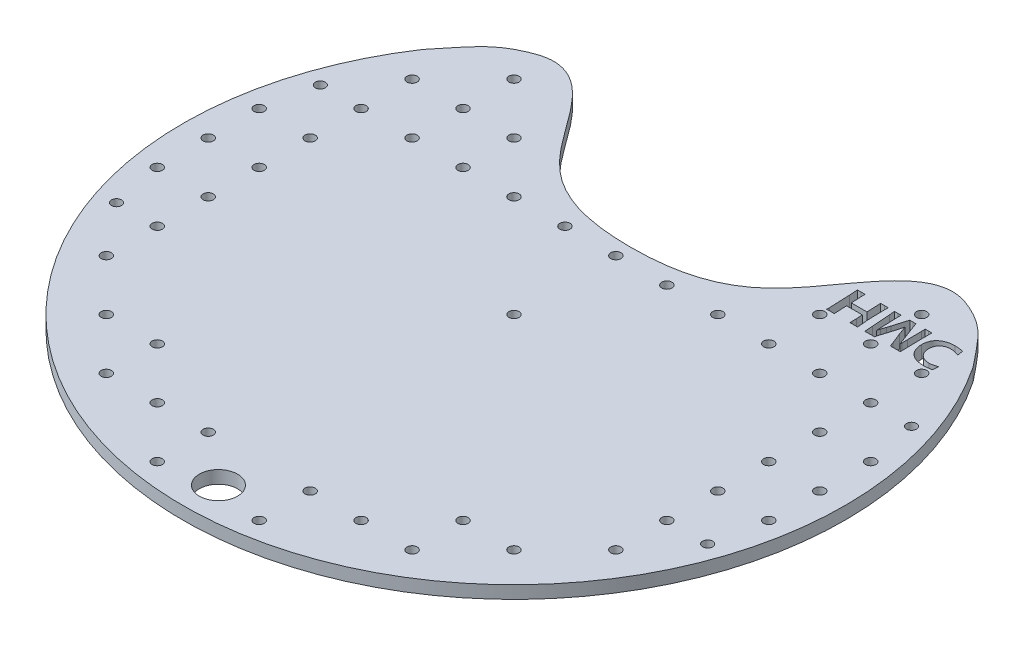
from build123d import *

# Parameters (mm, degrees)
SKETCH1_R               = 164.975
BOSS_EXTRUDE1_DEPTH     = 6.35
F_10_CLEARANCE_HOLE1_D  = 4.9784
CUT_EXTRUDE1_DEPTH      = 234.396280497
CUT_EXTRUDE1_DEPTH_BACK = 234.396280497
LPATTERN2_COUNT         = 7
LPATTERN2_PITCH         = 25.4
LPATTERN2_COUNT_DIR2    = 7
LPATTERN2_PITCH_DIR2    = 25.4
LPATTERN3_COUNT         = 5
LPATTERN3_PITCH         = 25.4
LPATTERN3_COUNT_DIR2    = 7
LPATTERN3_PITCH_DIR2    = 25.4
CUT_EXTRUDE2_DEPTH      = 234.396280641
SKETCH11_R              = 9.525
CUT_EXTRUDE3_DEPTH      = 234.396280641


with BuildPart() as part:
    # Sketch1 → Boss-Extrude1 (new body)
    with BuildSketch(Plane(origin=(0, 0, 0), x_dir=(1, 0, 0), z_dir=(0, 1, 0))):
        with Locations(Location((0, 0, 0), (0, 0, 270))):
            Circle(SKETCH1_R)
    extrude(amount=BOSS_EXTRUDE1_DEPTH)

    # #10 Clearance Hole1 (through all)
    with Locations(Plane(origin=(0, 6.35, 0), x_dir=(-1, 0, 0), z_dir=(0, 1, 0))):
        with Locations((147.32, 50.8), (147.32, -50.8), (-147.32, -50.8), (-147.32, 50.8)):
            Hole(F_10_CLEARANCE_HOLE1_D / 2)

    # Sketch5 → Cut-Extrude1 (cut, two sides: drawn at the far end of the back side and taken through both)
    with BuildSketch(Plane(origin=(0, 6.35, 0), x_dir=(1, 0, 0), z_dir=(0, 1, 0)).offset(-CUT_EXTRUDE1_DEPTH_BACK)):
        with BuildLine():
            ThreePointArc((137.173488465, 91.652521446), (0, 164.975), (-137.173488464, 91.652521447))
            add(Edge.make_bspline(
                [(-137.173488464, 91.652521447), (-125.705159191, 105.996558727), (-120.870534515, 112.272122591), (-90.353097544, 124.765284351), (-63.363213117, 88.003441051), (-42.154841731, 58.106834512), (1e-09, 58.106834512)],
                knots=[0, 0, 0, 0, 0.216330934, 0.275013743, 0.586828091, 1, 1, 1, 1], degree=3))
            add(Edge.make_bspline(
                [(137.173488466, 91.652521447), (125.705159193, 105.996558727), (120.870534517, 112.272122591), (90.353097545, 124.765284351), (63.363213118, 88.003441051), (42.154841732, 58.106834512), (1e-09, 58.106834512)],
                knots=[0, 0, 0, 0, 0.216330934, 0.275013743, 0.586828091, 1, 1, 1, 1], degree=3))
        make_face()
    extrude(amount=CUT_EXTRUDE1_DEPTH + CUT_EXTRUDE1_DEPTH_BACK, mode=Mode.SUBTRACT)

    # Sketch8 → #10 Clearance Hole2 (revolve, cut)
    with BuildSketch(Plane(origin=(0, 0, 0), x_dir=(0, 0, -1), z_dir=(1, 0, 0))):
        Polygon((0, 0), (0, 7.883816902), (2.5527, 6.35), (2.5527, 0), align=None)
    f_10_clearance_hole2 = revolve(axis=Axis((0, -6.35, 0), (0, 1, 0)), mode=Mode.SUBTRACT)

    # LPattern2: 10 Clearance Hole2 7 × 7, 36 skipped
    with Locations(*[(-i * LPATTERN2_PITCH, 0, j * LPATTERN2_PITCH_DIR2) for i in range(LPATTERN2_COUNT) for j in range(LPATTERN2_COUNT_DIR2) if (i, j) not in ((0, 0), (0, 1), (0, 2), (0, 3), (0, 4), (0, 5), (0, 6), (1, 0), (1, 1), (1, 2), (1, 3), (1, 4), (2, 0), (2, 1), (2, 2), (2, 3), (2, 4), (2, 6), (3, 0), (3, 1), (3, 2), (3, 3), (3, 6), (4, 0), (4, 1), (4, 2), (4, 3), (4, 5), (4, 6), (5, 4), (5, 5), (5, 6), (6, 2), (6, 3), (6, 4), (6, 5), (6, 6))]):
        add(f_10_clearance_hole2, mode=Mode.SUBTRACT)

    # LPattern3: 10 Clearance Hole2 5 × 7, 20 skipped
    with Locations(*[(-j * LPATTERN3_PITCH_DIR2, 0, -i * LPATTERN3_PITCH) for i in range(LPATTERN3_COUNT) for j in range(LPATTERN3_COUNT_DIR2) if (i, j) not in ((0, 0), (0, 1), (0, 2), (0, 3), (0, 4), (1, 0), (1, 1), (1, 2), (1, 3), (1, 4), (2, 6), (3, 0), (3, 1), (3, 2), (3, 6), (4, 0), (4, 1), (4, 2), (4, 3), (4, 5), (4, 6))]):
        add(f_10_clearance_hole2, mode=Mode.SUBTRACT)

    # Sketch10 → Cut-Extrude2 (cut, through all)
    with BuildSketch(Plane.XZ):
        with BuildLine():
            Line((74.993500001, -96.206834512), (75.260894532, -91.997975137))
            add(Edge.make_bspline(
                [(75.260894532, -91.997975137), (75.296562067, -91.434304127), (75.366562515, -90.328053782), (75.453626376, -88.698154201), (75.521456861, -87.130668601), (75.57094484, -85.870076422), (75.595967468, -84.914860995), (75.619923895, -84.262155806), (75.631210718, -83.663567502), (75.646271295, -83.121893626), (75.657307485, -82.635722801), (75.662386599, -82.206223979), (75.672282965, -81.831232152), (75.671176771, -81.599689665), (75.670667969, -81.493189981)],
                knots=[0, 0, 0, 0, 1.933852701, 3.795343699, 5.588570132, 7.305909625, 8.114800428, 8.860305979, 9.542201477, 10.164663024, 10.715709075, 11.207239194, 11.635363789, 12, 12, 12, 12], degree=3))
            Line((75.670667969, -81.493189981), (75.656777344, -80.204834512))
            add(Edge.make_bspline(
                [(75.656777344, -80.204834512), (75.873235113, -80.208656794), (76.272573451, -80.21570844), (76.820137012, -80.220481942), (77.265744768, -80.230600362), (77.528535454, -80.229585626), (77.643136719, -80.229143106)],
                knots=[0, 0, 0, 0, 1.307740905, 2.412623416, 3.307755656, 4, 4, 4, 4], degree=3))
            add(Edge.make_bspline(
                [(77.643136719, -80.229143106), (77.684808111, -80.22909413), (77.777411203, -80.228985293), (77.930229256, -80.230002988), (78.111936136, -80.224998579), (78.321460799, -80.222141476), (78.559915111, -80.218503149), (78.827307176, -80.214880175), (79.123676714, -80.212491971), (79.330852648, -80.207452823), (79.438500001, -80.204834512)],
                knots=[0, 0, 0, 0, 0.556996426, 1.237769835, 2.042468985, 2.986395297, 4.038613416, 5.230067347, 6.560759871, 8, 8, 8, 8], degree=3))
            Line((79.438500001, -80.204834512), (79.198886719, -85.441600137))
            Line((79.198886719, -85.441600137), (79.171105469, -86.650084512))
            Line((79.171105469, -86.650084512), (86.946382813, -86.650084512))
            Line((86.946382813, -86.650084512), (87.147796876, -83.507330606))
            add(Edge.make_bspline(
                [(87.147796876, -83.507330606), (87.152418859, -83.378841984), (87.161288579, -83.132268631), (87.174078387, -82.78032981), (87.190940939, -82.462190441), (87.195572763, -82.179594161), (87.202748973, -81.930725272), (87.210438175, -81.716636244), (87.214378271, -81.536034295), (87.213962911, -81.427210673), (87.213777344, -81.378592325)],
                knots=[0, 0, 0, 0, 1.448767269, 2.780225978, 3.968329787, 5.038214136, 5.964669347, 6.773786438, 7.452173378, 8, 8, 8, 8], degree=3))
            Line((87.213777344, -81.378592325), (87.213777344, -80.204834512))
            Line((87.213777344, -80.204834512), (89.207082032, -80.229143106))
            add(Edge.make_bspline(
                [(89.207082032, -80.229143106), (89.234862965, -80.229113505), (89.304315296, -80.229039503), (89.429352263, -80.229905416), (89.593693154, -80.224912512), (89.797430194, -80.222014681), (90.040515962, -80.218442036), (90.32411493, -80.214874363), (90.64710329, -80.212394159), (90.875119002, -80.207446586), (90.995500001, -80.204834512)],
                knots=[0, 0, 0, 0, 0.372774362, 0.931935905, 1.677646405, 2.578651669, 3.666021163, 4.939761605, 6.384345762, 8, 8, 8, 8], degree=3))
            Line((90.995500001, -80.204834512), (90.509328126, -86.594522012))
            Line((90.509328126, -86.594522012), (90.384312501, -91.331225137))
            Line((90.384312501, -91.331225137), (90.349585938, -94.109350137))
            add(Edge.make_bspline(
                [(90.349585938, -94.109350137), (90.348469775, -94.244784067), (90.346342379, -94.502919799), (90.342688567, -94.868705251), (90.339958587, -95.192825723), (90.334272922, -95.475244218), (90.337477769, -95.717214907), (90.331243322, -95.917428149), (90.332379624, -96.076032468), (90.332269886, -96.167478145), (90.332222657, -96.206834512)],
                knots=[0, 0, 0, 0, 1.549650664, 2.95361887, 4.18541869, 5.258296333, 6.185403894, 6.953692896, 7.549690614, 8, 8, 8, 8], degree=3))
            Line((90.332222657, -96.206834512), (88.498660157, -96.182525919))
            add(Edge.make_bspline(
                [(88.498660157, -96.182525919), (88.463933944, -96.182561883), (88.380591032, -96.182648197), (88.235877078, -96.181719054), (88.051855167, -96.186746864), (87.828440245, -96.189630289), (87.565675907, -96.193178136), (87.26239932, -96.196811897), (86.919733835, -96.199252004), (86.677826527, -96.204219762), (86.550500001, -96.206834512)],
                knots=[0, 0, 0, 0, 0.427767225, 1.02664134, 1.782497944, 2.695179415, 3.77895019, 5.019557088, 6.431260943, 8, 8, 8, 8], degree=3))
            add(Edge.make_bspline(
                [(86.550500001, -96.206834512), (86.586485974, -95.636235209), (86.659383616, -94.480358638), (86.74650908, -92.724312908), (86.808788568, -90.92408713), (86.833280291, -89.70953216), (86.845675782, -89.094834512)],
                knots=[0, 0, 0, 0, 0.963741244, 1.952273546, 2.963626461, 4, 4, 4, 4], degree=3))
            Line((86.845675782, -89.094834512), (79.070398438, -89.094834512))
            Line((79.070398438, -89.094834512), (78.841203126, -93.494689981))
            Line((78.841203126, -93.494689981), (78.775222657, -96.206834512))
            Line((78.775222657, -96.206834512), (76.820117188, -96.182525919))
            add(Edge.make_bspline(
                [(76.820117188, -96.182525919), (76.786548562, -96.182563228), (76.70783592, -96.182650712), (76.571223774, -96.18173454), (76.398778724, -96.186733568), (76.189254171, -96.189624316), (75.9426959, -96.193200779), (75.659097166, -96.196777392), (75.338423869, -96.199280948), (75.112723416, -96.204223612), (74.993500001, -96.206834512)],
                knots=[0, 0, 0, 0, 0.441017417, 1.034109805, 1.794636722, 2.707213271, 3.787052657, 5.034160148, 6.433332531, 8, 8, 8, 8], degree=3))
        make_face()
        with BuildLine():
            Line((93.440250001, -96.206834512), (93.718062501, -93.557197794))
            Line((93.718062501, -93.557197794), (94.419539063, -84.250479044))
            Line((94.419539063, -84.250479044), (94.662625001, -80.204834512))
            add(Edge.make_bspline(
                [(94.662625001, -80.204834512), (94.801527395, -80.207452039), (95.070059188, -80.212512347), (95.459024515, -80.214930174), (95.819020699, -80.218585831), (96.148923287, -80.222111702), (96.449889377, -80.225196714), (96.721897115, -80.230033293), (96.964997249, -80.228963381), (97.116635784, -80.229086006), (97.187246094, -80.229143106)],
                knots=[0, 0, 0, 0, 1.320599842, 2.553037664, 3.697451499, 4.742839111, 5.689201549, 6.55854536, 7.328788297, 8, 8, 8, 8], degree=3))
            add(Edge.make_bspline(
                [(97.187246094, -80.229143106), (97.246280865, -80.229090364), (97.374768307, -80.228975573), (97.584301068, -80.230010623), (97.827366363, -80.225066085), (98.102868762, -80.22215013), (98.410776843, -80.218539706), (98.751094909, -80.214900357), (99.12501275, -80.212483982), (99.385441457, -80.207451521), (99.520871094, -80.204834512)],
                knots=[0, 0, 0, 0, 0.607101392, 1.321338323, 2.154699767, 3.107090072, 4.154705205, 5.321352926, 6.607034512, 8, 8, 8, 8], degree=3))
            add(Edge.make_bspline(
                [(99.520871094, -80.204834512), (99.549465886, -80.351912027), (99.601976841, -80.622002492), (99.679174882, -80.993436016), (99.744840597, -81.295373477), (99.800504248, -81.552008406), (99.865178079, -81.802247014), (99.951634929, -82.090109037), (100.049377341, -82.441236016), (100.175336284, -82.848117157), (100.32128956, -83.308420659), (100.483172899, -83.81856163), (100.668310576, -84.375014617), (100.799723644, -84.761042132), (100.868261719, -84.962373575)],
                knots=[0, 0, 0, 0, 1.089636465, 2.000988523, 2.758865794, 3.336851585, 3.910591721, 4.637931397, 5.52252999, 6.561085464, 7.735214062, 9.03441109, 10.453306378, 12, 12, 12, 12], degree=3))
            add(Edge.make_bspline(
                [(100.868261719, -84.962373575), (101.070793138, -85.590711197), (101.471542376, -86.834003849), (101.818378346, -88.093396568), (101.989929688, -88.716314981)],
                knots=[0, 0, 0, 0, 1.010763832, 2, 2, 2, 2], degree=3))
            Line((101.989929688, -88.716314981), (102.885875001, -92.067428262))
            Line((102.885875001, -92.067428262), (104.431207032, -87.764807169))
            Line((104.431207032, -87.764807169), (106.678015626, -82.173830606))
            add(Edge.make_bspline(
                [(106.678015626, -82.173830606), (106.718493871, -82.073533756), (106.804743413, -81.859824953), (106.899737754, -81.566313464), (106.996259645, -81.27896555), (107.083030733, -80.983102886), (107.201058167, -80.619100685), (107.280608856, -80.350892403), (107.323929688, -80.204834512)],
                knots=[0, 0, 0, 0, 0.93885965, 2.000487272, 2.677508593, 3.570935418, 4.677206962, 6, 6, 6, 6], degree=3))
            add(Edge.make_bspline(
                [(107.323929688, -80.204834512), (107.560066399, -80.208649089), (108.018437453, -80.216053661), (108.686376572, -80.221210987), (109.313738642, -80.230927874), (109.718901599, -80.229724261), (109.914531251, -80.229143106)],
                knots=[0, 0, 0, 0, 1.093888232, 2.123374637, 3.093886645, 4, 4, 4, 4], degree=3))
            add(Edge.make_bspline(
                [(109.914531251, -80.229143106), (109.982826424, -80.229084208), (110.127519588, -80.228959423), (110.359044978, -80.230028799), (110.618318248, -80.225153176), (110.90655218, -80.222133416), (111.222563993, -80.218597649), (111.567511512, -80.21490146), (111.940272833, -80.212535619), (112.198385558, -80.207454802), (112.331500001, -80.204834512)],
                knots=[0, 0, 0, 0, 0.678116828, 1.436688195, 2.298777731, 3.252807928, 4.298780083, 5.436695179, 6.678046989, 8, 8, 8, 8], degree=3))
            add(Edge.make_bspline(
                [(112.331500001, -80.204834512), (112.304530914, -80.782393729), (112.249254182, -81.966178195), (112.193393009, -83.787259259), (112.146136442, -85.697222146), (112.126964663, -87.330702634), (112.11203267, -88.63526952), (112.106558245, -89.559018843), (112.097968225, -90.417903813), (112.095762174, -91.213157024), (112.091909413, -91.94357041), (112.08891475, -92.609164647), (112.084104405, -93.209926352), (112.084672805, -93.589608459), (112.084941407, -93.769029825)],
                knots=[0, 0, 0, 0, 1.53411821, 3.144379404, 4.834122094, 6.603420039, 7.478817988, 8.295833905, 9.054494969, 9.75785264, 10.405925655, 10.9925714, 11.523932753, 12, 12, 12, 12], degree=3))
            add(Edge.make_bspline(
                [(112.084941407, -93.769029825), (112.084390699, -93.941508549), (112.083226406, -94.306158724), (112.093099916, -94.884899127), (112.098117261, -95.525059108), (112.105431919, -95.973012995), (112.109250001, -96.206834512)],
                knots=[0, 0, 0, 0, 0.848948267, 1.794825047, 2.848949926, 4, 4, 4, 4], degree=3))
            add(Edge.make_bspline(
                [(112.109250001, -96.206834512), (111.924047021, -96.203006704), (111.584903717, -96.195997228), (111.124147113, -96.191328917), (110.759579981, -96.181152386), (110.548873854, -96.182117601), (110.459738282, -96.182525919)],
                knots=[0, 0, 0, 0, 1.347428785, 2.46740874, 3.351663852, 4, 4, 4, 4], degree=3))
            add(Edge.make_bspline(
                [(110.459738282, -96.182525919), (110.345135845, -96.182002606), (110.098546658, -96.180876597), (109.703872842, -96.190710455), (109.257011833, -96.19583688), (108.942182041, -96.203027528), (108.775500001, -96.206834512)],
                knots=[0, 0, 0, 0, 0.816386421, 1.756612415, 2.812271173, 4, 4, 4, 4], degree=3))
            add(Edge.make_bspline(
                [(108.775500001, -96.206834512), (108.781590061, -96.017004323), (108.79324969, -95.653567903), (108.805142414, -95.134898267), (108.821878033, -94.668531134), (108.825762879, -94.375598683), (108.827589844, -94.237838419)],
                knots=[0, 0, 0, 0, 1.157083643, 2.215276389, 3.160680236, 4, 4, 4, 4], degree=3))
            Line((108.827589844, -94.237838419), (108.938714844, -87.264744669))
            add(Edge.make_bspline(
                [(108.938714844, -87.264744669), (108.945367784, -86.775107335), (108.958547458, -85.805120927), (108.961541, -84.835049773), (108.963023438, -84.354658731)],
                knots=[0, 0, 0, 0, 1.009575658, 2, 2, 2, 2], degree=3))
            Line((108.963023438, -84.354658731), (108.952605469, -83.406623575))
            Line((108.952605469, -83.406623575), (104.646511719, -94.8108267))
            Line((104.646511719, -94.8108267), (104.146449219, -96.206834512))
            add(Edge.make_bspline(
                [(104.146449219, -96.206834512), (103.97976765, -96.203007533), (103.674195621, -96.195991653), (103.258578235, -96.191309135), (102.92758667, -96.1811226), (102.735397851, -96.182105552), (102.653207032, -96.182525919)],
                knots=[0, 0, 0, 0, 1.339610706, 2.455865781, 3.339640791, 4, 4, 4, 4], degree=3))
            add(Edge.make_bspline(
                [(102.653207032, -96.182525919), (102.557125447, -96.182055767), (102.341787611, -96.181002064), (101.983007142, -96.191053778), (101.552346869, -96.195938819), (101.240987856, -96.203018292), (101.073148438, -96.206834512)],
                knots=[0, 0, 0, 0, 0.729563581, 1.635096278, 2.725188452, 4, 4, 4, 4], degree=3))
            Line((101.073148438, -96.206834512), (98.927046876, -88.983709512))
            add(Edge.make_bspline(
                [(98.927046876, -88.983709512), (98.916810342, -88.946615194), (98.894008335, -88.86398713), (98.851841307, -88.728663239), (98.798586403, -88.566982632), (98.736589818, -88.378510612), (98.667958045, -88.162559887), (98.58722296, -87.922066059), (98.496317294, -87.655266485), (98.434875705, -87.46738704), (98.402675782, -87.368924356)],
                knots=[0, 0, 0, 0, 0.543892365, 1.211527128, 2.003175877, 2.950043785, 4.015951267, 5.20598606, 6.535730656, 8, 8, 8, 8], degree=3))
            Line((98.402675782, -87.368924356), (97.631746094, -84.9762642))
            add(Edge.make_bspline(
                [(97.631746094, -84.9762642), (97.597296756, -84.873525273), (97.535700619, -84.689825925), (97.4691453, -84.45640574), (97.422013271, -84.256033533), (97.368641266, -84.046834604), (97.300523679, -83.771001634), (97.247634573, -83.565158928), (97.218500001, -83.451768106)],
                knots=[0, 0, 0, 0, 1.234310681, 2.206973301, 2.763460044, 3.578987492, 4.666357423, 6, 6, 6, 6], degree=3))
            Line((97.218500001, -83.451768106), (97.138628907, -84.951955606))
            add(Edge.make_bspline(
                [(97.138628907, -84.951955606), (97.136510984, -85.016786741), (97.131971463, -85.155744698), (97.120299764, -85.379049946), (97.110150125, -85.632569762), (97.100760465, -85.917413784), (97.085651318, -86.232171121), (97.072133919, -86.577139075), (97.058213493, -86.951028622), (97.049420501, -87.210336982), (97.044867188, -87.344615762)],
                knots=[0, 0, 0, 0, 0.650128294, 1.393473977, 2.241137564, 3.193141075, 4.249945902, 5.399484712, 6.653363815, 8, 8, 8, 8], degree=3))
            Line((97.044867188, -87.344615762), (96.801781251, -94.612885294))
            add(Edge.make_bspline(
                [(96.801781251, -94.612885294), (96.800872529, -94.713596024), (96.798866948, -94.935868204), (96.789581928, -95.301588348), (96.788104157, -95.732242999), (96.785703637, -96.041306657), (96.784417969, -96.206834512)],
                knots=[0, 0, 0, 0, 0.758166629, 1.673300845, 2.753869915, 4, 4, 4, 4], degree=3))
            Line((96.784417969, -96.206834512), (95.124488282, -96.182525919))
            add(Edge.make_bspline(
                [(95.124488282, -96.182525919), (95.036510431, -96.182131038), (94.82580479, -96.181185304), (94.456608009, -96.191437699), (93.983117959, -96.196000249), (93.632398347, -96.20299972), (93.440250001, -96.206834512)],
                knots=[0, 0, 0, 0, 0.626725854, 1.50099907, 2.630875265, 4, 4, 4, 4], degree=3))
        make_face()
        with BuildLine():
            add(Edge.make_bspline(
                [(128.111250001, -93.095334512), (128.028251854, -93.571764565), (127.86098679, -94.531907728), (127.731822185, -95.497916401), (127.666750001, -95.984584512)],
                knots=[0, 0, 0, 0, 0.992414614, 2, 2, 2, 2], degree=3))
            add(Edge.make_bspline(
                [(127.666750001, -95.984584512), (127.448198873, -96.024177674), (127.02005863, -96.101740421), (126.389302601, -96.191818228), (125.786879565, -96.275445554), (125.214504685, -96.33309739), (124.675872244, -96.37335546), (124.175899308, -96.406414388), (123.71498763, -96.423609158), (123.420859517, -96.427318155), (123.280785157, -96.429084512)],
                knots=[0, 0, 0, 0, 1.207519765, 2.365523393, 3.463927203, 4.514158486, 5.492613088, 6.400685351, 7.238348981, 8, 8, 8, 8], degree=3))
            add(Edge.make_bspline(
                [(123.280785157, -96.429084512), (122.988854642, -96.422896855), (122.410539645, -96.410639092), (121.552593062, -96.318140656), (120.714382287, -96.165814409), (119.898243608, -95.951842422), (119.112046115, -95.672440627), (118.364495592, -95.319270497), (117.656619495, -94.896745185), (117.101061979, -94.490383056), (116.684828902, -94.132307939), (116.397507653, -93.845615475), (116.12667331, -93.551120592), (115.884595361, -93.236720322), (115.661738622, -92.90986905), (115.459359659, -92.56971308), (115.282539551, -92.213751548), (115.073458115, -91.720169208), (114.862331898, -91.074556324), (114.688298638, -90.265379998), (114.571071909, -89.424683959), (114.559744704, -88.850996615), (114.554000001, -88.56004545)],
                knots=[0, 0, 0, 0, 1.318265777, 2.611487418, 3.892232749, 5.162822796, 6.417916999, 7.655026152, 8.890510445, 10.135854753, 10.758477525, 11.36843922, 11.968029465, 12.564099535, 13.158608609, 13.753944603, 14.350129292, 14.952153253, 16.173878804, 17.410601279, 18.686761033, 20, 20, 20, 20], degree=3))
            add(Edge.make_bspline(
                [(114.554000001, -88.56004545), (114.560927129, -88.243491962), (114.57456535, -87.620257286), (114.714776858, -86.706006696), (114.921382295, -85.825488749), (115.226374105, -84.988648856), (115.606355503, -84.199150248), (116.066218418, -83.468493048), (116.605660468, -82.804845521), (117.2162011, -82.205289459), (117.893386308, -81.672929163), (118.63567056, -81.218265056), (119.43212827, -80.828282181), (120.285253885, -80.521881352), (121.174713869, -80.278186189), (122.090597453, -80.111389239), (123.024620959, -80.001773561), (123.654362643, -79.989016115), (123.971843751, -79.982584512)],
                knots=[0, 0, 0, 0, 1.057818798, 2.082647581, 3.086326694, 4.078178631, 5.054644415, 6.01154728, 6.958303494, 7.908164782, 8.867640255, 9.832341333, 10.81398044, 11.827990303, 12.859094656, 13.894701684, 14.938624429, 16, 16, 16, 16], degree=3))
            add(Edge.make_bspline(
                [(123.971843751, -79.982584512), (124.294971775, -79.988182292), (124.957284937, -79.99965602), (125.971258856, -80.0881833), (127.029503014, -80.225436159), (127.744867589, -80.358787202), (128.111250001, -80.427084512)],
                knots=[0, 0, 0, 0, 0.929895616, 1.906000282, 2.927533325, 4, 4, 4, 4], degree=3))
            add(Edge.make_bspline(
                [(128.111250001, -80.427084512), (128.120696675, -80.59723151), (128.138112868, -80.910919967), (128.159422105, -81.341889285), (128.188383871, -81.692428453), (128.20721838, -81.899501767), (128.215429688, -81.989779825)],
                knots=[0, 0, 0, 0, 1.305569111, 2.406989058, 3.305492671, 4, 4, 4, 4], degree=3))
            Line((128.215429688, -81.989779825), (128.333500001, -83.316334512))
            add(Edge.make_bspline(
                [(128.333500001, -83.316334512), (128.120894896, -83.236583134), (127.716013724, -83.084706106), (127.134725431, -82.884931584), (126.607112436, -82.731019696), (126.128552569, -82.613783194), (125.683298245, -82.528954543), (125.25688843, -82.469171826), (124.840651782, -82.432913691), (124.565736737, -82.42917652), (124.430234376, -82.427334512)],
                knots=[0, 0, 0, 0, 1.353206117, 2.577020327, 3.661995836, 4.627397868, 5.51221958, 6.361951924, 7.19262555, 8, 8, 8, 8], degree=3))
            add(Edge.make_bspline(
                [(124.430234376, -82.427334512), (124.22163496, -82.431800139), (123.807780054, -82.440659806), (123.193989901, -82.51802885), (122.591311747, -82.632953684), (122.006159139, -82.804426247), (121.440081857, -83.020005306), (120.907375523, -83.300015808), (120.407542676, -83.63496431), (119.946578439, -84.025062528), (119.524141298, -84.460327021), (119.159100126, -84.950052145), (118.837118211, -85.477119553), (118.575971344, -86.047224352), (118.368137084, -86.642650487), (118.217432919, -87.25633116), (118.129743349, -87.883812287), (118.116599046, -88.306276909), (118.110000001, -88.518373575)],
                knots=[0, 0, 0, 0, 1.015620633, 2.014960499, 3.009006065, 4.001083016, 4.981086867, 5.954516494, 6.925592074, 7.905920236, 8.890842094, 9.873000602, 10.87473916, 11.893843655, 12.920902256, 13.94239015, 14.966985239, 16, 16, 16, 16], degree=3))
            add(Edge.make_bspline(
                [(118.110000001, -88.518373575), (118.11721654, -88.767674551), (118.131321961, -89.254957367), (118.245259675, -89.965681232), (118.429776401, -90.63658451), (118.641843521, -91.166467618), (118.856470608, -91.562004283), (119.037041454, -91.845320513), (119.243168492, -92.112215406), (119.469511566, -92.367439682), (119.719144161, -92.606798741), (119.993188723, -92.828660661), (120.283773392, -93.042759475), (120.600890058, -93.235460885), (120.936812317, -93.414136662), (121.29507558, -93.566126824), (121.672719349, -93.694180813), (122.067483473, -93.803333155), (122.483733293, -93.881235939), (122.918368253, -93.939659256), (123.372620364, -93.980469832), (123.68236393, -93.98303169), (123.839882813, -93.984334512)],
                knots=[0, 0, 0, 0, 1.666784478, 3.257891107, 4.800020589, 6.31398346, 7.062273569, 7.807513352, 8.558562107, 9.315335644, 10.087439485, 10.868612455, 11.672364814, 12.499638707, 13.348124984, 14.215303783, 15.09918828, 16.013868649, 16.952260476, 17.928964542, 18.946782992, 20, 20, 20, 20], degree=3))
            add(Edge.make_bspline(
                [(123.839882813, -93.984334512), (123.992766221, -93.981520968), (124.306011815, -93.975756244), (124.78588763, -93.931721723), (125.287528103, -93.86161504), (125.810196748, -93.764617277), (126.355310584, -93.637307786), (126.922028513, -93.48566133), (127.511285398, -93.303935233), (127.907935253, -93.166024687), (128.111250001, -93.095334512)],
                knots=[0, 0, 0, 0, 0.837016575, 1.714978482, 2.636429424, 3.60980122, 4.624534877, 5.7007478, 6.82144951, 8, 8, 8, 8], degree=3))
        make_face()
    extrude(amount=-CUT_EXTRUDE2_DEPTH, mode=Mode.SUBTRACT)

    # Mirror1 copy 1 sketch → Mirror1 copy 1 (revolve, cut)
    with BuildSketch(Plane(origin=(25.4, 0, 127), x_dir=(0, 0, -1), z_dir=(-1, 0, 0))):
        Polygon((0, 0), (0, -7.883816902), (2.5527, -6.35), (2.5527, 0), align=None)
    revolve(axis=Axis((25.4, -6.35, 127), (0, -1, 0)), mode=Mode.SUBTRACT)

    # Mirror1 copy 2 sketch → Mirror1 copy 2 (revolve, cut)
    with BuildSketch(Plane(origin=(25.4, 0, 152.4), x_dir=(0, 0, -1), z_dir=(-1, 0, 0))):
        Polygon((0, 0), (0, -7.883816902), (2.5527, -6.35), (2.5527, 0), align=None)
    revolve(axis=Axis((25.4, -6.35, 152.4), (0, -1, 0)), mode=Mode.SUBTRACT)

    # Mirror1 copy 3 sketch → Mirror1 copy 3 (revolve, cut)
    with BuildSketch(Plane(origin=(50.8, 0, 127), x_dir=(0, 0, -1), z_dir=(-1, 0, 0))):
        Polygon((0, 0), (0, -7.883816902), (2.5527, -6.35), (2.5527, 0), align=None)
    revolve(axis=Axis((50.8, -6.35, 127), (0, -1, 0)), mode=Mode.SUBTRACT)

    # Mirror1 copy 4 sketch → Mirror1 copy 4 (revolve, cut)
    with BuildSketch(Plane(origin=(76.2, 0, 101.6), x_dir=(0, 0, -1), z_dir=(-1, 0, 0))):
        Polygon((0, 0), (0, -7.883816902), (2.5527, -6.35), (2.5527, 0), align=None)
    revolve(axis=Axis((76.2, -6.35, 101.6), (0, -1, 0)), mode=Mode.SUBTRACT)

    # Mirror1 copy 5 sketch → Mirror1 copy 5 (revolve, cut)
    with BuildSketch(Plane(origin=(76.2, 0, 127), x_dir=(0, 0, -1), z_dir=(-1, 0, 0))):
        Polygon((0, 0), (0, -7.883816902), (2.5527, -6.35), (2.5527, 0), align=None)
    revolve(axis=Axis((76.2, -6.35, 127), (0, -1, 0)), mode=Mode.SUBTRACT)

    # Mirror1 copy 6 sketch → Mirror1 copy 6 (revolve, cut)
    with BuildSketch(Plane(origin=(101.6, 0, 101.6), x_dir=(0, 0, -1), z_dir=(-1, 0, 0))):
        Polygon((0, 0), (0, -7.883816902), (2.5527, -6.35), (2.5527, 0), align=None)
    revolve(axis=Axis((101.6, -6.35, 101.6), (0, -1, 0)), mode=Mode.SUBTRACT)

    # Mirror1 copy 7 sketch → Mirror1 copy 7 (revolve, cut)
    with BuildSketch(Plane(origin=(127, 0, 0), x_dir=(0, 0, -1), z_dir=(-1, 0, 0))):
        Polygon((0, 0), (0, -7.883816902), (2.5527, -6.35), (2.5527, 0), align=None)
    revolve(axis=Axis((127, -6.35, 0), (0, -1, 0)), mode=Mode.SUBTRACT)

    # Mirror1 copy 8 sketch → Mirror1 copy 8 (revolve, cut)
    with BuildSketch(Plane(origin=(127, 0, 25.4), x_dir=(0, 0, -1), z_dir=(-1, 0, 0))):
        Polygon((0, 0), (0, -7.883816902), (2.5527, -6.35), (2.5527, 0), align=None)
    revolve(axis=Axis((127, -6.35, 25.4), (0, -1, 0)), mode=Mode.SUBTRACT)

    # Mirror1 copy 9 sketch → Mirror1 copy 9 (revolve, cut)
    with BuildSketch(Plane(origin=(127, 0, 50.8), x_dir=(0, 0, -1), z_dir=(-1, 0, 0))):
        Polygon((0, 0), (0, -7.883816902), (2.5527, -6.35), (2.5527, 0), align=None)
    revolve(axis=Axis((127, -6.35, 50.8), (0, -1, 0)), mode=Mode.SUBTRACT)

    # Mirror1 copy 10 sketch → Mirror1 copy 10 (revolve, cut)
    with BuildSketch(Plane(origin=(127, 0, 76.2), x_dir=(0, 0, -1), z_dir=(-1, 0, 0))):
        Polygon((0, 0), (0, -7.883816902), (2.5527, -6.35), (2.5527, 0), align=None)
    revolve(axis=Axis((127, -6.35, 76.2), (0, -1, 0)), mode=Mode.SUBTRACT)

    # Mirror1 copy 11 sketch → Mirror1 copy 11 (revolve, cut)
    with BuildSketch(Plane(origin=(152.4, 0, 0), x_dir=(0, 0, -1), z_dir=(-1, 0, 0))):
        Polygon((0, 0), (0, -7.883816902), (2.5527, -6.35), (2.5527, 0), align=None)
    revolve(axis=Axis((152.4, -6.35, 0), (0, -1, 0)), mode=Mode.SUBTRACT)

    # Mirror1 copy 12 sketch → Mirror1 copy 12 (revolve, cut)
    with BuildSketch(Plane(origin=(152.4, 0, 25.4), x_dir=(0, 0, -1), z_dir=(-1, 0, 0))):
        Polygon((0, 0), (0, -7.883816902), (2.5527, -6.35), (2.5527, 0), align=None)
    revolve(axis=Axis((152.4, -6.35, 25.4), (0, -1, 0)), mode=Mode.SUBTRACT)

    # Mirror1 copy 13 sketch → Mirror1 copy 13 (revolve, cut)
    with BuildSketch(Plane(origin=(0, 0, 0), x_dir=(0, 0, -1), z_dir=(-1, 0, 0))):
        Polygon((0, 0), (0, -7.883816902), (2.5527, -6.35), (2.5527, 0), align=None)
    revolve(axis=Axis((0, -6.35, 0), (0, -1, 0)), mode=Mode.SUBTRACT)

    # Mirror1 copy 14 sketch → Mirror1 copy 14 (revolve, cut)
    with BuildSketch(Plane(origin=(127, 0, 0), x_dir=(0, 0, -1), z_dir=(-1, 0, 0))):
        Polygon((0, 0), (0, -7.883816902), (2.5527, -6.35), (2.5527, 0), align=None)
    revolve(axis=Axis((127, -6.35, 0), (0, -1, 0)), mode=Mode.SUBTRACT)

    # Mirror1 copy 15 sketch → Mirror1 copy 15 (revolve, cut)
    with BuildSketch(Plane(origin=(152.4, 0, 0), x_dir=(0, 0, -1), z_dir=(-1, 0, 0))):
        Polygon((0, 0), (0, -7.883816902), (2.5527, -6.35), (2.5527, 0), align=None)
    revolve(axis=Axis((152.4, -6.35, 0), (0, -1, 0)), mode=Mode.SUBTRACT)

    # Mirror1 copy 16 sketch → Mirror1 copy 16 (revolve, cut)
    with BuildSketch(Plane(origin=(127, 0, -25.4), x_dir=(0, 0, -1), z_dir=(-1, 0, 0))):
        Polygon((0, 0), (0, -7.883816902), (2.5527, -6.35), (2.5527, 0), align=None)
    revolve(axis=Axis((127, -6.35, -25.4), (0, -1, 0)), mode=Mode.SUBTRACT)

    # Mirror1 copy 17 sketch → Mirror1 copy 17 (revolve, cut)
    with BuildSketch(Plane(origin=(152.4, 0, -25.4), x_dir=(0, 0, -1), z_dir=(-1, 0, 0))):
        Polygon((0, 0), (0, -7.883816902), (2.5527, -6.35), (2.5527, 0), align=None)
    revolve(axis=Axis((152.4, -6.35, -25.4), (0, -1, 0)), mode=Mode.SUBTRACT)

    # Mirror1 copy 18 sketch → Mirror1 copy 18 (revolve, cut)
    with BuildSketch(Plane(origin=(0, 0, -50.8), x_dir=(0, 0, -1), z_dir=(-1, 0, 0))):
        Polygon((0, 0), (0, -7.883816902), (2.5527, -6.35), (2.5527, 0), align=None)
    revolve(axis=Axis((0, -6.35, -50.8), (0, -1, 0)), mode=Mode.SUBTRACT)

    # Mirror1 copy 19 sketch → Mirror1 copy 19 (revolve, cut)
    with BuildSketch(Plane(origin=(25.4, 0, -50.8), x_dir=(0, 0, -1), z_dir=(-1, 0, 0))):
        Polygon((0, 0), (0, -7.883816902), (2.5527, -6.35), (2.5527, 0), align=None)
    revolve(axis=Axis((25.4, -6.35, -50.8), (0, -1, 0)), mode=Mode.SUBTRACT)

    # Mirror1 copy 20 sketch → Mirror1 copy 20 (revolve, cut)
    with BuildSketch(Plane(origin=(50.8, 0, -50.8), x_dir=(0, 0, -1), z_dir=(-1, 0, 0))):
        Polygon((0, 0), (0, -7.883816902), (2.5527, -6.35), (2.5527, 0), align=None)
    revolve(axis=Axis((50.8, -6.35, -50.8), (0, -1, 0)), mode=Mode.SUBTRACT)

    # Mirror1 copy 21 sketch → Mirror1 copy 21 (revolve, cut)
    with BuildSketch(Plane(origin=(76.2, 0, -50.8), x_dir=(0, 0, -1), z_dir=(-1, 0, 0))):
        Polygon((0, 0), (0, -7.883816902), (2.5527, -6.35), (2.5527, 0), align=None)
    revolve(axis=Axis((76.2, -6.35, -50.8), (0, -1, 0)), mode=Mode.SUBTRACT)

    # Mirror1 copy 22 sketch → Mirror1 copy 22 (revolve, cut)
    with BuildSketch(Plane(origin=(101.6, 0, -50.8), x_dir=(0, 0, -1), z_dir=(-1, 0, 0))):
        Polygon((0, 0), (0, -7.883816902), (2.5527, -6.35), (2.5527, 0), align=None)
    revolve(axis=Axis((101.6, -6.35, -50.8), (0, -1, 0)), mode=Mode.SUBTRACT)

    # Mirror1 copy 23 sketch → Mirror1 copy 23 (revolve, cut)
    with BuildSketch(Plane(origin=(127, 0, -50.8), x_dir=(0, 0, -1), z_dir=(-1, 0, 0))):
        Polygon((0, 0), (0, -7.883816902), (2.5527, -6.35), (2.5527, 0), align=None)
    revolve(axis=Axis((127, -6.35, -50.8), (0, -1, 0)), mode=Mode.SUBTRACT)

    # Mirror1 copy 24 sketch → Mirror1 copy 24 (revolve, cut)
    with BuildSketch(Plane(origin=(76.2, 0, -76.2), x_dir=(0, 0, -1), z_dir=(-1, 0, 0))):
        Polygon((0, 0), (0, -7.883816902), (2.5527, -6.35), (2.5527, 0), align=None)
    revolve(axis=Axis((76.2, -6.35, -76.2), (0, -1, 0)), mode=Mode.SUBTRACT)

    # Mirror1 copy 25 sketch → Mirror1 copy 25 (revolve, cut)
    with BuildSketch(Plane(origin=(101.6, 0, -76.2), x_dir=(0, 0, -1), z_dir=(-1, 0, 0))):
        Polygon((0, 0), (0, -7.883816902), (2.5527, -6.35), (2.5527, 0), align=None)
    revolve(axis=Axis((101.6, -6.35, -76.2), (0, -1, 0)), mode=Mode.SUBTRACT)

    # Mirror1 copy 26 sketch → Mirror1 copy 26 (revolve, cut)
    with BuildSketch(Plane(origin=(127, 0, -76.2), x_dir=(0, 0, -1), z_dir=(-1, 0, 0))):
        Polygon((0, 0), (0, -7.883816902), (2.5527, -6.35), (2.5527, 0), align=None)
    revolve(axis=Axis((127, -6.35, -76.2), (0, -1, 0)), mode=Mode.SUBTRACT)

    # Mirror1 copy 27 sketch → Mirror1 copy 27 (revolve, cut)
    with BuildSketch(Plane(origin=(101.6, 0, -101.6), x_dir=(0, 0, -1), z_dir=(-1, 0, 0))):
        Polygon((0, 0), (0, -7.883816902), (2.5527, -6.35), (2.5527, 0), align=None)
    revolve(axis=Axis((101.6, -6.35, -101.6), (0, -1, 0)), mode=Mode.SUBTRACT)

    # Mirror1 copy 28 sketch → Mirror1 copy 28 (revolve, cut)
    with BuildSketch(Plane(origin=(0, 0, 0), x_dir=(0, 0, -1), z_dir=(-1, 0, 0))):
        Polygon((0, 0), (0, -7.883816902), (2.5527, -6.35), (2.5527, 0), align=None)
    revolve(axis=Axis((0, -6.35, 0), (0, -1, 0)), mode=Mode.SUBTRACT)

    # Sketch11 → Cut-Extrude3 (cut, through all)
    with BuildSketch(Plane(origin=(0, 6.35, 0), x_dir=(1, 0, 0), z_dir=(0, 1, 0))):
        with Locations(Location((0, -147.32, 0), (0, 0, 270))):
            Circle(SKETCH11_R)
    extrude(amount=-CUT_EXTRUDE3_DEPTH, mode=Mode.SUBTRACT)


solid = part.part
